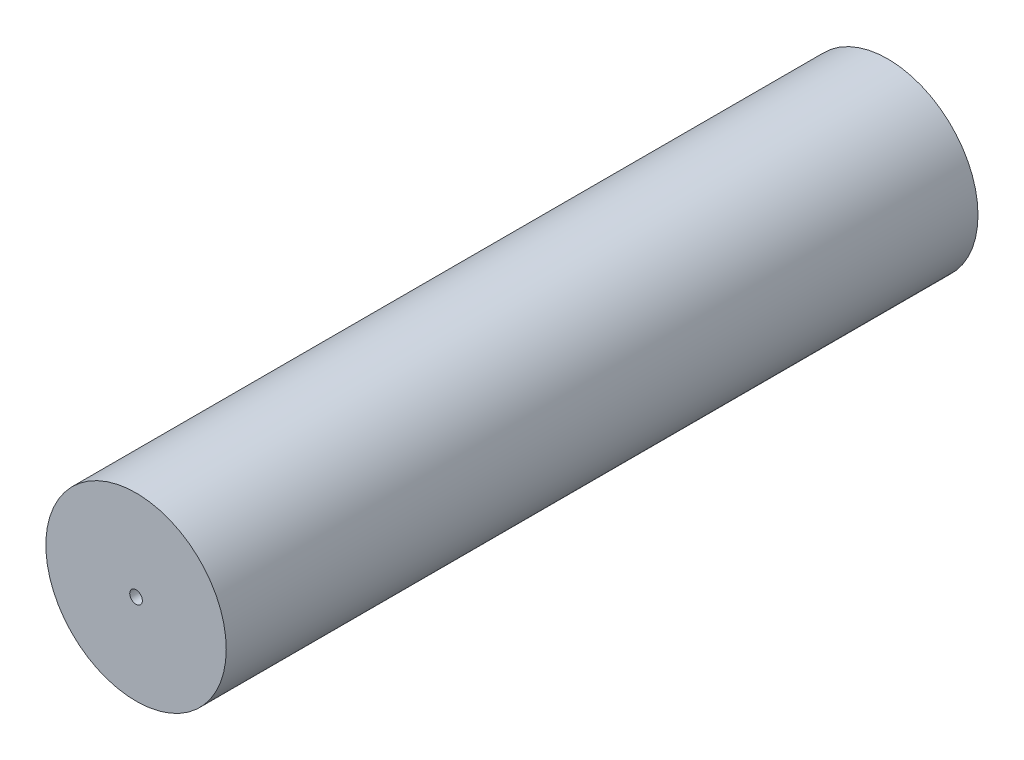
from build123d import *

# Parameters (mm, degrees)
SKETCH_1_R          = 30
EXTRUDE_1_DEPTH     = 250
SKETCH_2_R          = 2.1
CUT_EXTRUDE_1_DEPTH = 250


with BuildPart() as part:
    # 草图1 → 凸台-拉伸1 (new body)
    with BuildSketch(Plane.XY):
        Circle(SKETCH_1_R)
    extrude(amount=EXTRUDE_1_DEPTH)

    # 草图2 → 切除-拉伸1 (cut)
    with BuildSketch(Plane.XY.offset(250)):
        Circle(SKETCH_2_R)
    extrude(amount=-CUT_EXTRUDE_1_DEPTH, mode=Mode.SUBTRACT)


solid = part.part
